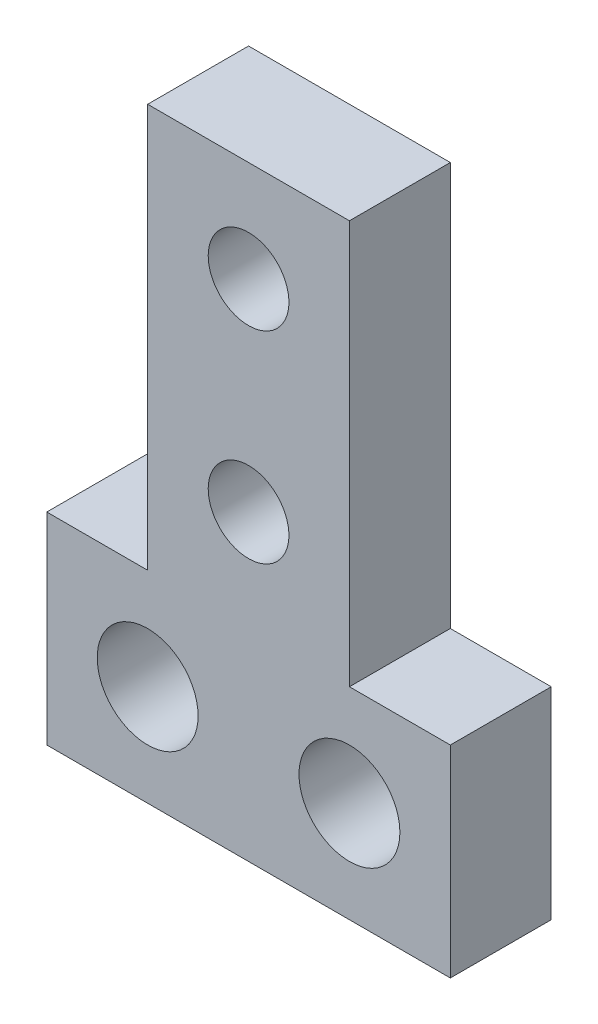
from build123d import *

# Parameters (mm, degrees)
SKETCH_1_W      = 20
SKETCH_1_H      = 10
SKETCH_1_R      = 2.5
EXTRUDE_1_DEPTH = 5
SKETCH_2_W      = 10
SKETCH_2_H      = 20
SKETCH_2_R      = 2
EXTRUDE_2_DEPTH = 5


with BuildPart() as part:
    # 草图1 → 凸台-拉伸1 (new body)
    with BuildSketch(Plane.XY):
        Rectangle(SKETCH_1_W, SKETCH_1_H)
        with Locations((-5, 0)):
            Circle(SKETCH_1_R, mode=Mode.SUBTRACT)
        with Locations((5, 0)):
            Circle(SKETCH_1_R, mode=Mode.SUBTRACT)
    extrude(amount=EXTRUDE_1_DEPTH)

    # 草图2 → 凸台-拉伸2 (add)
    with BuildSketch(Plane(origin=(0, 0, 0), x_dir=(-1, 0, 0), z_dir=(0, 0, -1))):
        with Locations((0, 15)):
            Rectangle(SKETCH_2_W, SKETCH_2_H)
        with Locations((0, 20)):
            Circle(SKETCH_2_R, mode=Mode.SUBTRACT)
        with Locations((0, 10)):
            Circle(SKETCH_2_R, mode=Mode.SUBTRACT)
    extrude(amount=-EXTRUDE_2_DEPTH)


solid = part.part
